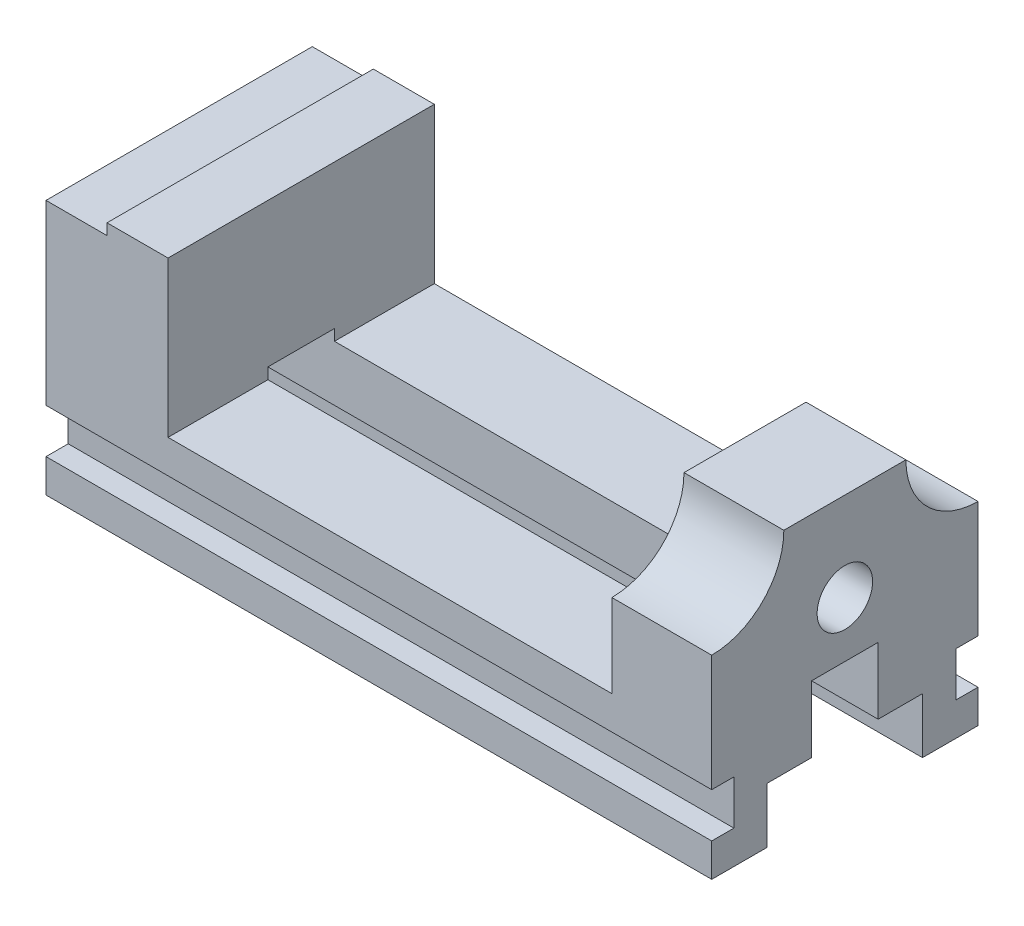
from build123d import *

# Parameters (mm, degrees)
EXTRUDE1_DEPTH = 76.2
EXTRUDE2_DEPTH = 28.575
SKETCH4_R      = 7.9375
EXTRUDE3_DEPTH = 76.2
EXTRUDE4_DEPTH = 219.867836833
SKETCH6_W      = 12.7
SKETCH6_H      = 12.7
EXTRUDE5_DEPTH = 219.867836833


with BuildPart() as part:
    # Sketch2 → Extrude1 (new body)
    with BuildSketch(Plane.XY):
        Polygon((17.4625, 76.2), (17.4625, 73.025), (0, 73.025), (0, 0), (190.5, 0), (190.5, 76.2), (161.925, 76.2), (161.925, 31.75), (34.925, 31.75), (34.925, 76.2), align=None)
    extrude(amount=-EXTRUDE1_DEPTH)

    # Sketch3 → Extrude2 (cut)
    with BuildSketch(Plane(origin=(190.5, 0, 0), x_dir=(0, 0, -1), z_dir=(1, 0, 0))):
        with BuildLine():
            Line((0, 55.5625), (0, 76.2))
            Line((0, 76.2), (20.6375, 76.2))
            ThreePointArc((20.6375, 76.2), (14.592916197, 61.607083803), (0, 55.5625))
        make_face()
        with BuildLine():
            Line((76.2, 76.2), (55.5625, 76.2))
            ThreePointArc((55.5625, 76.2), (61.607083803, 61.607083803), (76.2, 55.5625))
            Line((76.2, 55.5625), (76.2, 76.2))
        make_face()
    extrude(amount=-EXTRUDE2_DEPTH, mode=Mode.SUBTRACT)

    # Sketch4 → Extrude3 (cut)
    with BuildSketch(Plane(origin=(190.5, 0, 0), x_dir=(0, 0, -1), z_dir=(1, 0, 0))):
        with Locations((38.1, 50.8)):
            Circle(SKETCH4_R)
    extrude(amount=-EXTRUDE3_DEPTH, mode=Mode.SUBTRACT)

    # Sketch5 → Extrude4 (cut, through all)
    with BuildSketch(Plane(origin=(190.5, 0, 0), x_dir=(0, 0, -1), z_dir=(1, 0, 0))):
        Polygon((15.875, 15.875), (28.575, 15.875), (28.575, 34.925), (47.625, 34.925), (47.625, 15.875), (60.325, 15.875), (60.325, 0), (15.875, 0), align=None)
    extrude(amount=-EXTRUDE4_DEPTH, mode=Mode.SUBTRACT)

    # Sketch6 → Extrude5 (cut, through all)
    with BuildSketch(Plane(origin=(190.5, 0, 0), x_dir=(0, 0, -1), z_dir=(1, 0, 0))):
        with Locations((0, 15.875)):
            Rectangle(SKETCH6_W, SKETCH6_H)
        with Locations((76.2, 15.875)):
            Rectangle(SKETCH6_W, SKETCH6_H)
    extrude(amount=-EXTRUDE5_DEPTH, mode=Mode.SUBTRACT)


solid = part.part
